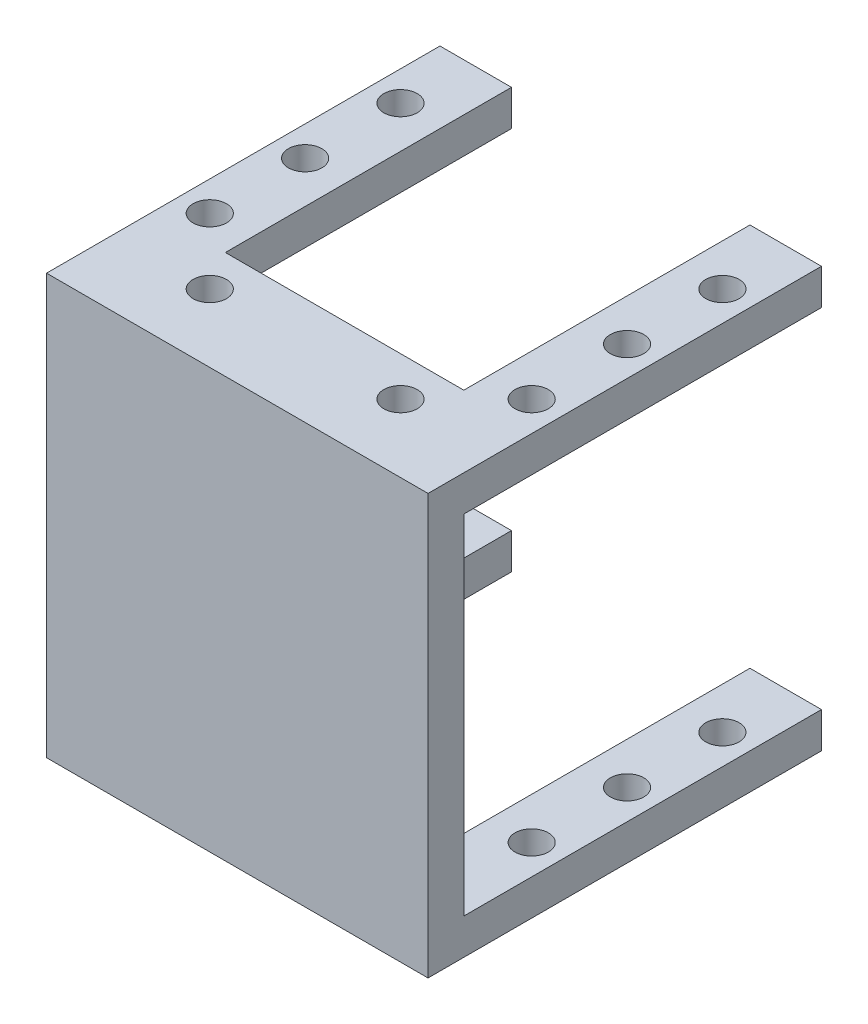
from build123d import *

# Parameters (mm, degrees)
SKETCH1_R           = 1.4
BOSS_EXTRUDE1_DEPTH = 3
SKETCH2_R           = 1.4
BOSS_EXTRUDE2_DEPTH = 3
SKETCH3_W           = 32
SKETCH3_H           = 35.2
BOSS_EXTRUDE3_DEPTH = 3


with BuildPart() as part:
    # Sketch1 → Boss-Extrude1 (new body)
    with BuildSketch(Plane(origin=(0, 0, 0), x_dir=(1, 0, 0), z_dir=(0, 1, 0))):
        Polygon((-16, 24), (-16, -6), (16, -6), (16, 24), (10, 24), (10, 0), (-10, 0), (-10, 24), align=None)
        with Locations(Location((-8, -3.307692308, 0), (0, 0, 270))):
            Circle(SKETCH1_R, mode=Mode.SUBTRACT)
        with Locations(Location((8, -3.307692308, 0), (0, 0, 90))):
            Circle(SKETCH1_R, mode=Mode.SUBTRACT)
        with Locations(Location((-13.5, 18.192307692, 0), (0, 0, 270))):
            Circle(SKETCH1_R, mode=Mode.SUBTRACT)
        with Locations(Location((-13.5, 10.192307692, 0), (0, 0, 270))):
            Circle(SKETCH1_R, mode=Mode.SUBTRACT)
        with Locations(Location((-13.5, 2.192307692, 0), (0, 0, 270))):
            Circle(SKETCH1_R, mode=Mode.SUBTRACT)
        with Locations(Location((13.5, 2.192307692, 0), (0, 0, 90))):
            Circle(SKETCH1_R, mode=Mode.SUBTRACT)
        with Locations(Location((13.5, 10.192307692, 0), (0, 0, 90))):
            Circle(SKETCH1_R, mode=Mode.SUBTRACT)
        with Locations(Location((13.5, 18.192307692, 0), (0, 0, 90))):
            Circle(SKETCH1_R, mode=Mode.SUBTRACT)
    extrude(amount=BOSS_EXTRUDE1_DEPTH)



with BuildPart() as body_2:
    # Sketch2 → Boss-Extrude2 (new body)
    with BuildSketch(Plane(origin=(0, 32.2, 0), x_dir=(1, 0, 0), z_dir=(0, 1, 0))):
        Polygon((16, 24), (10, 24), (10, 0), (-10, 0), (-10, 24), (-16, 24), (-16, -6), (16, -6), align=None)
        with Locations(Location((-13.5, 18.192307692, 0), (0, 0, 270))):
            Circle(SKETCH2_R, mode=Mode.SUBTRACT)
        with Locations(Location((13.5, 18.192307692, 0), (0, 0, 90))):
            Circle(SKETCH2_R, mode=Mode.SUBTRACT)
        with Locations(Location((13.5, 10.192307692, 0), (0, 0, 90))):
            Circle(SKETCH2_R, mode=Mode.SUBTRACT)
        with Locations(Location((13.5, 2.192307692, 0), (0, 0, 90))):
            Circle(SKETCH2_R, mode=Mode.SUBTRACT)
        with Locations(Location((8, -3.307692308, 0), (0, 0, 90))):
            Circle(SKETCH2_R, mode=Mode.SUBTRACT)
        with Locations(Location((-8, -3.307692308, 0), (0, 0, 270))):
            Circle(SKETCH2_R, mode=Mode.SUBTRACT)
        with Locations(Location((-13.5, 10.192307692, 0), (0, 0, 270))):
            Circle(SKETCH2_R, mode=Mode.SUBTRACT)
        with Locations(Location((-13.5, 2.192307692, 0), (0, 0, 270))):
            Circle(SKETCH2_R, mode=Mode.SUBTRACT)
    extrude(amount=BOSS_EXTRUDE2_DEPTH)


with BuildPart() as part_1:
    add(part.part)

    add(body_2.part)  # Boss-Extrude3 merges body 2
    # Sketch3 → Boss-Extrude3 (add)
    with BuildSketch(Plane.XY.offset(6)):
        with Locations((0, 17.6)):
            Rectangle(SKETCH3_W, SKETCH3_H)
    extrude(amount=BOSS_EXTRUDE3_DEPTH)


solid = part_1.part
